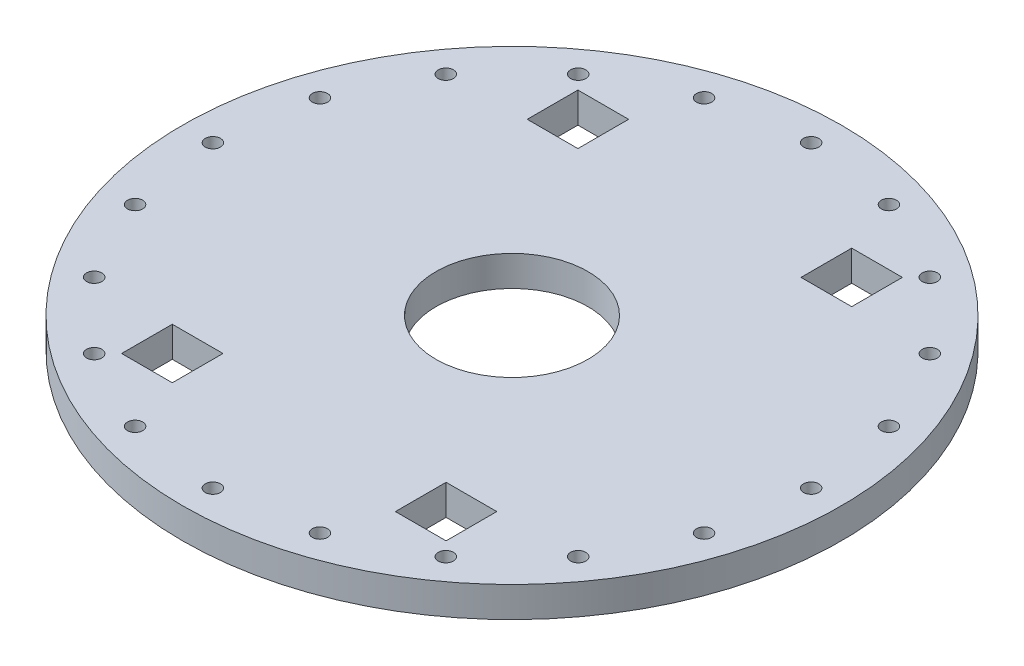
from build123d import *

# Parameters (mm, degrees)
SKETCH1_R           = 32.5
SKETCH1_R_2         = 7.5
SKETCH1_W           = 5
SKETCH1_H           = 5
BOSS_EXTRUDE1_DEPTH = 3
SKETCH2_R           = 0.75
CUT_EXTRUDE1_DEPTH  = 47.059743812


with BuildPart() as part:
    # Sketch1 → Boss-Extrude1 (new body)
    with BuildSketch(Plane(origin=(0, 0, 0), x_dir=(1, 0, 0), z_dir=(0, 1, 0))):
        with Locations(Location((0, 0, 0), (0, 0, 270))):
            Circle(SKETCH1_R)
        with Locations(Location((0, 0, 0), (0, 0, 270))):
            Circle(SKETCH1_R_2, mode=Mode.SUBTRACT)
        with Locations((-13.5, -20)):
            Rectangle(SKETCH1_W, SKETCH1_H, mode=Mode.SUBTRACT)
        with Locations((-13.5, 20)):
            Rectangle(SKETCH1_W, SKETCH1_H, mode=Mode.SUBTRACT)
        with Locations((13.5, 20)):
            Rectangle(SKETCH1_W, SKETCH1_H, mode=Mode.SUBTRACT)
        with Locations((13.5, -20)):
            Rectangle(SKETCH1_W, SKETCH1_H, mode=Mode.SUBTRACT)
    extrude(amount=BOSS_EXTRUDE1_DEPTH)

    # Sketch2 → Cut-Extrude1 (cut, through all)
    with BuildSketch(Plane.XZ):
        with Locations(Location((0, -29.5, 0), (0, 0, 270))):
            Circle(SKETCH2_R)
        with Locations(Location((-9.116001334, -28.056167231, 0), (0, 0, 270))):
            Circle(SKETCH2_R)
        with Locations(Location((-17.339664943, -23.866001334, 0), (0, 0, 270))):
            Circle(SKETCH2_R)
        with Locations(Location((-23.866001334, -17.339664943, 0), (0, 0, 270))):
            Circle(SKETCH2_R)
        with Locations(Location((-28.056167231, -9.116001334, 0), (0, 0, 270))):
            Circle(SKETCH2_R)
        with Locations(Location((-29.5, 0, 0), (0, 0, 270))):
            Circle(SKETCH2_R)
        with Locations(Location((-28.056167231, 9.116001334, 0), (0, 0, 270))):
            Circle(SKETCH2_R)
        with Locations(Location((-23.866001334, 17.339664943, 0), (0, 0, 270))):
            Circle(SKETCH2_R)
        with Locations(Location((-17.339664943, 23.866001334, 0), (0, 0, 270))):
            Circle(SKETCH2_R)
        with Locations(Location((-9.116001334, 28.056167231, 0), (0, 0, 270))):
            Circle(SKETCH2_R)
        with Locations(Location((0, 29.5, 0), (0, 0, 270))):
            Circle(SKETCH2_R)
        with Locations(Location((9.116001334, 28.056167231, 0), (0, 0, 270))):
            Circle(SKETCH2_R)
        with Locations(Location((17.339664943, 23.866001334, 0), (0, 0, 270))):
            Circle(SKETCH2_R)
        with Locations(Location((23.866001334, 17.339664943, 0), (0, 0, 270))):
            Circle(SKETCH2_R)
        with Locations(Location((28.056167231, 9.116001334, 0), (0, 0, 270))):
            Circle(SKETCH2_R)
        with Locations(Location((29.5, 0, 0), (0, 0, 270))):
            Circle(SKETCH2_R)
        with Locations(Location((28.056167231, -9.116001334, 0), (0, 0, 270))):
            Circle(SKETCH2_R)
        with Locations(Location((23.866001334, -17.339664943, 0), (0, 0, 270))):
            Circle(SKETCH2_R)
        with Locations(Location((17.339664943, -23.866001334, 0), (0, 0, 270))):
            Circle(SKETCH2_R)
        with Locations(Location((9.116001334, -28.056167231, 0), (0, 0, 270))):
            Circle(SKETCH2_R)
    extrude(amount=-CUT_EXTRUDE1_DEPTH, mode=Mode.SUBTRACT)


solid = part.part
